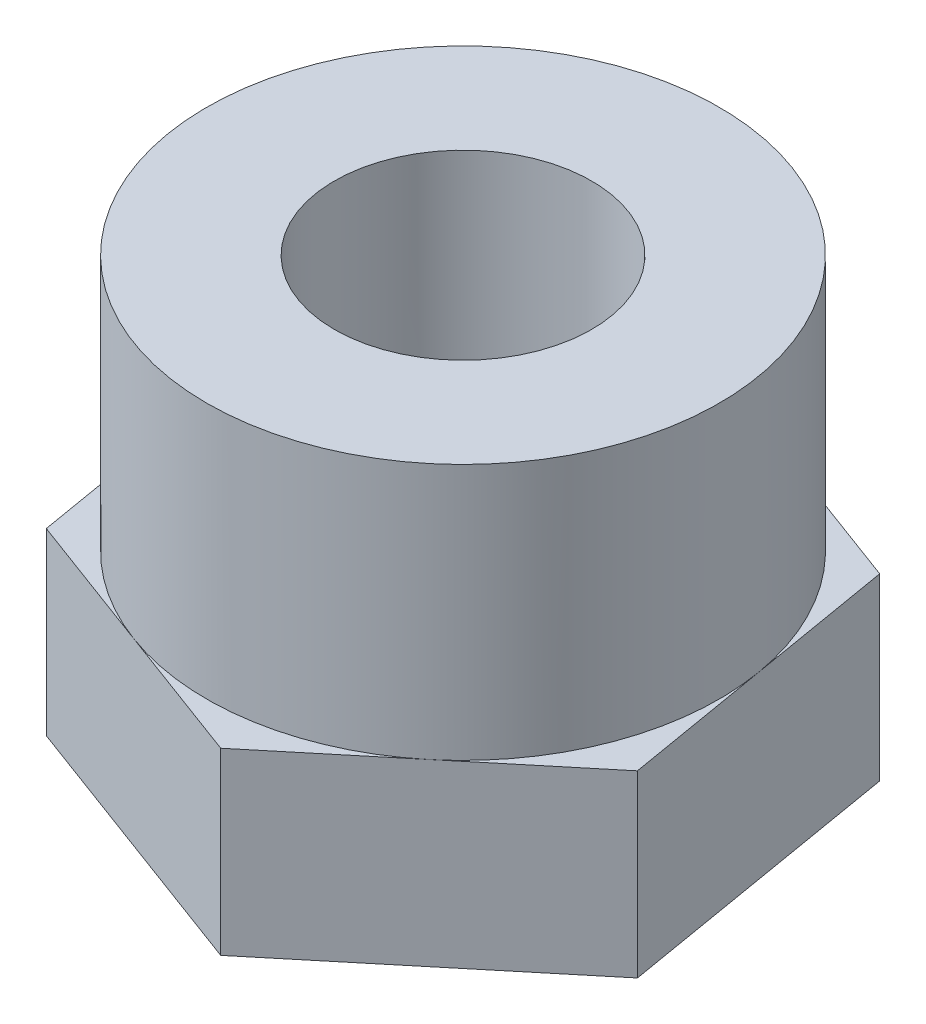
from build123d import *

# Parameters (mm, degrees)
SKETCH1_R           = 12.7
BOSS_EXTRUDE1_DEPTH = 12.7
BOSS_EXTRUDE2_DEPTH = 8.89
CUT_EXTRUDE1_REACH  = 36.662
SKETCH4_R           = 0.6
SKETCH5_R           = 6.3754
CUT_EXTRUDE2_DEPTH  = 11.83132


with BuildPart() as part:
    # Sketch1 → Boss-Extrude1 (new body)
    with BuildSketch(Plane(origin=(0, 0, 0), x_dir=(1, 0, 0), z_dir=(0, 1, 0))):
        with Locations(Location((0, 0, 0), (0, 0, 270))):
            Circle(SKETCH1_R)
    extrude(amount=BOSS_EXTRUDE1_DEPTH)

    # Sketch2 → Boss-Extrude2 (add)
    with BuildSketch(Plane(origin=(0, 0, 0), x_dir=(-1, 0, 0), z_dir=(0, -1, 0))):
        Polygon((-11.29479914, 9.353119572), (-13.747438724, -5.105023199), (-2.452639584, -14.458142772), (11.29479914, -9.353119572), (13.747438724, 5.105023199), (2.452639584, 14.458142772), align=None)
    extrude(amount=BOSS_EXTRUDE2_DEPTH)

    # Sketch3 → Revolve1 (revolve)
    with BuildSketch(Plane.XY, mode=Mode.PRIVATE) as revolve1_sk:
        Polygon((-1, -15.64499815), (-12.7, -8.89), (0, -8.89), (0, -15.64499815), align=None)
    revolve(revolve1_sk.sketch.rotate(Axis((0, -8.89, 0), (0, -1, 0)), 110.372156134), axis=Axis((0, -8.89, 0), (0, -1, 0)))

    # Sketch4 → Cut-Extrude1 (cut, up to next)
    with BuildSketch(Plane.XZ.offset(15.64499815), mode=Mode.PRIVATE) as cut_extrude1_sk1:
        with Locations(Location((0, 0, 0), (0, 0, 270))):
            Circle(SKETCH4_R)
    cut_extrude1_tool1 = extrude(cut_extrude1_sk1.sketch, amount=-CUT_EXTRUDE1_REACH, mode=Mode.PRIVATE) & part.part
    add(cut_extrude1_tool1.solids().sort_by_distance((0, -15.644998, 0))[0], mode=Mode.SUBTRACT)

    # Sketch5 → Cut-Extrude2 (cut)
    with BuildSketch(Plane(origin=(0, 12.7, 0), x_dir=(1, 0, 0), z_dir=(0, 1, 0))):
        with Locations(Location((0, 0, 0), (0, 0, 270))):
            Circle(SKETCH5_R)
    extrude(amount=-CUT_EXTRUDE2_DEPTH, mode=Mode.SUBTRACT)

    # Sketch6 → Cut-Revolve1 (revolve, cut)
    with BuildSketch(Plane.XY, mode=Mode.PRIVATE) as cut_revolve1_sk:
        Polygon((0, 0.86868), (6.3754, 0.86868), (0, -16.64758754), align=None)
    revolve(cut_revolve1_sk.sketch.rotate(Axis((0, 0.86868, 0), (0, -1, 0)), 270), axis=Axis((0, 0.86868, 0), (0, -1, 0)), mode=Mode.SUBTRACT)


solid = part.part
